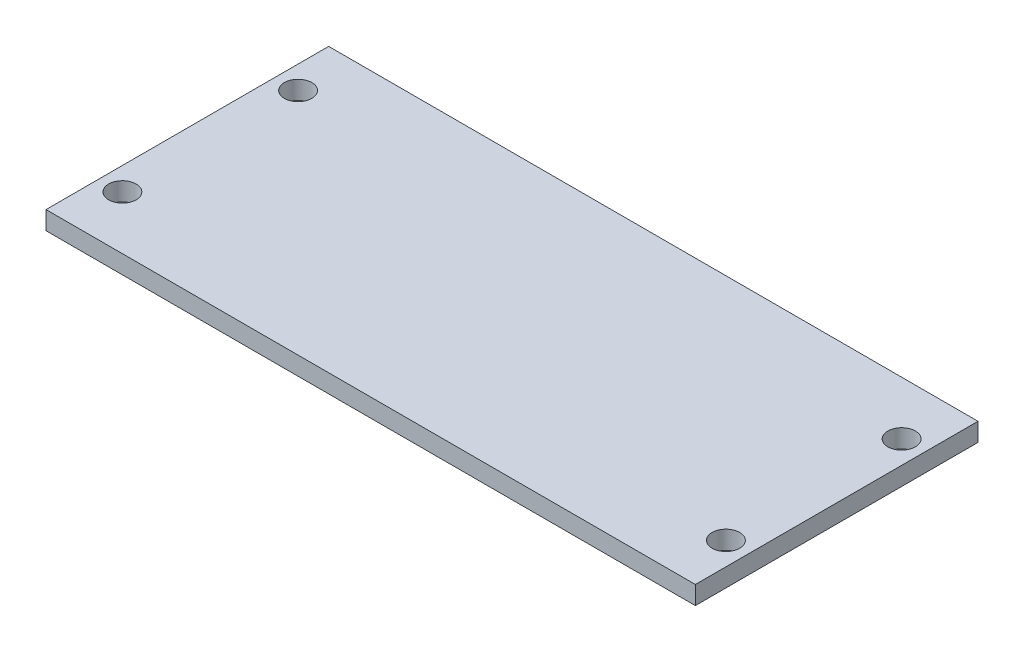
from build123d import *

# Parameters (mm, degrees)
SKETCH3_W           = 425
SKETCH3_H           = 185
SKETCH3_R           = 9
BOSS_EXTRUDE1_DEPTH = 12


with BuildPart() as part:
    # Sketch3 → Boss-Extrude1 (new body)
    with BuildSketch(Plane(origin=(0, 0, 0), x_dir=(1, 0, 0), z_dir=(0, 1, 0))):
        Rectangle(SKETCH3_W, SKETCH3_H)
        with Locations(Location((-197.5, 57.5, 0), (0, 0, 270))):
            Circle(SKETCH3_R, mode=Mode.SUBTRACT)
        with Locations(Location((-197.5, -57.5, 0), (0, 0, 270))):
            Circle(SKETCH3_R, mode=Mode.SUBTRACT)
        with Locations(Location((197.5, 57.5, 0), (0, 0, 90))):
            Circle(SKETCH3_R, mode=Mode.SUBTRACT)
        with Locations(Location((197.5, -57.5, 0), (0, 0, 90))):
            Circle(SKETCH3_R, mode=Mode.SUBTRACT)
    extrude(amount=BOSS_EXTRUDE1_DEPTH)


solid = part.part
